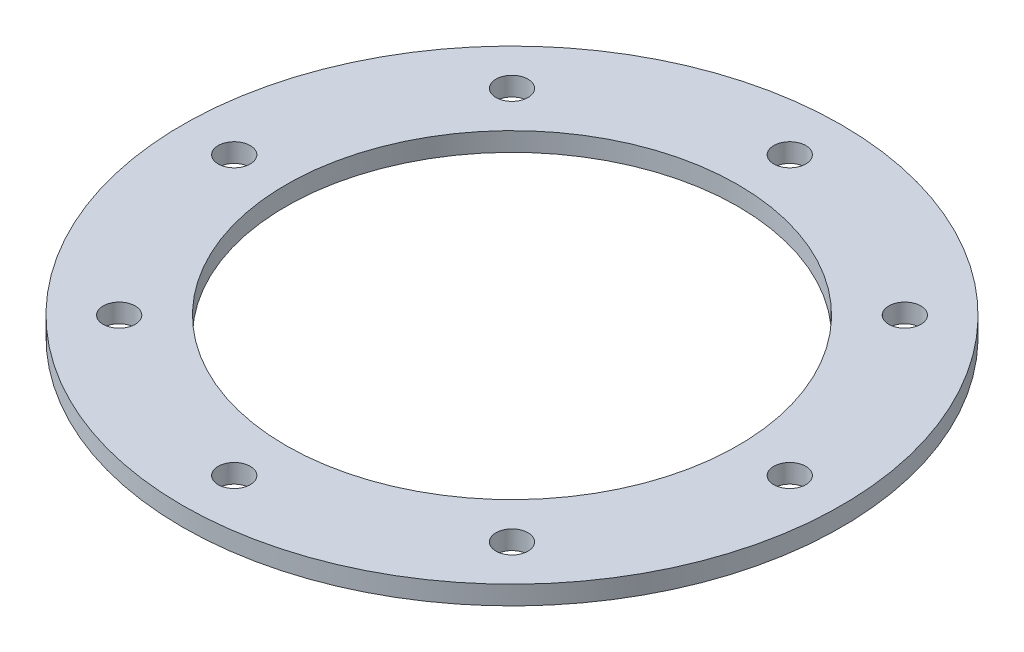
from build123d import *

# Parameters (mm, degrees)
SKETCH_1_R      = 70
SKETCH_1_R_2    = 48
SKETCH_1_R_3    = 3.4
EXTRUDE_1_DEPTH = 4


with BuildPart() as part:
    # Эскиз1 → Бобышка-Вытянуть1 (new body)
    with BuildSketch(Plane(origin=(0, 0, 0), x_dir=(1, 0, 0), z_dir=(0, 1, 0))):
        with Locations(Location((0, 0, 0), (0, 0, 270))):
            Circle(SKETCH_1_R)
        with Locations(Location((0, 0, 0), (0, 0, 270))):
            Circle(SKETCH_1_R_2, mode=Mode.SUBTRACT)
        with Locations(Location((59, 0, 0), (0, 0, 270))):
            Circle(SKETCH_1_R_3, mode=Mode.SUBTRACT)
        with Locations(Location((41.71930009, -41.71930009, 0), (0, 0, 270))):
            Circle(SKETCH_1_R_3, mode=Mode.SUBTRACT)
        with Locations(Location((0, -59, 0), (0, 0, 270))):
            Circle(SKETCH_1_R_3, mode=Mode.SUBTRACT)
        with Locations(Location((-41.71930009, -41.71930009, 0), (0, 0, 270))):
            Circle(SKETCH_1_R_3, mode=Mode.SUBTRACT)
        with Locations(Location((-59, 0, 0), (0, 0, 270))):
            Circle(SKETCH_1_R_3, mode=Mode.SUBTRACT)
        with Locations(Location((-41.71930009, 41.71930009, 0), (0, 0, 270))):
            Circle(SKETCH_1_R_3, mode=Mode.SUBTRACT)
        with Locations(Location((0, 59, 0), (0, 0, 270))):
            Circle(SKETCH_1_R_3, mode=Mode.SUBTRACT)
        with Locations(Location((41.71930009, 41.71930009, 0), (0, 0, 270))):
            Circle(SKETCH_1_R_3, mode=Mode.SUBTRACT)
    extrude(amount=EXTRUDE_1_DEPTH)


solid = part.part
